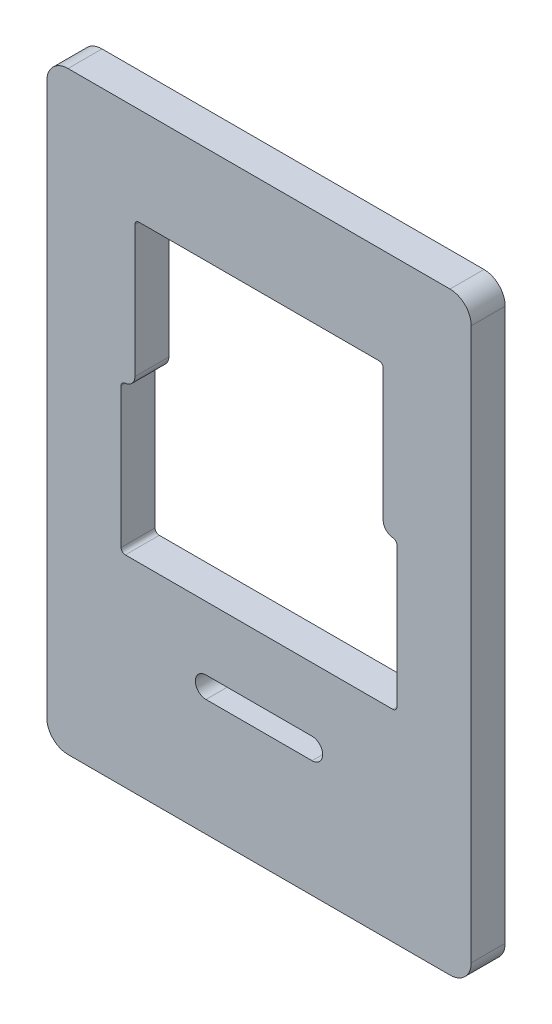
from build123d import *

# Parameters (mm, degrees)
MAINBODYS_W                = 20
MAINBODYS_H                = 28
MAIN_BODY_DEPTH            = 1.6
GROUND_CUT_DEPTH           = 18.278888853
MIDCUTS_W                  = 13
MIDCUTS_H                  = 7
MID_CUT_DEPTH              = 18.278888853
TOPPOWERACCESSCUTS_W       = 11.7
TOPPOWERACCESSCUTS_H       = 6.9
TOP_POWER_ACCESS_CUT_DEPTH = 18.278888853
MC_FILLET_R                = 0.5
ALL_INNER_CUTS_FILLETS_R   = 0.2
OUTER_FILLETS_R            = 1


with BuildPart() as part:
    # MainBodyS → MAIN BODY (new body)
    with BuildSketch(Plane.XY):
        Rectangle(MAINBODYS_W, MAINBODYS_H)
    extrude(amount=-MAIN_BODY_DEPTH)

    # GroundCutS → GROUND CUT (cut, through all)
    with BuildSketch(Plane.XY):
        with BuildLine():
            Line((-2.5, -7.5), (2.5, -7.5))
            ThreePointArc((2.5, -7.5), (3, -8), (2.5, -8.5))
            Line((2.5, -8.5), (-2.5, -8.5))
            ThreePointArc((-2.5, -8.5), (-3, -8), (-2.5, -7.5))
        make_face()
    extrude(amount=-GROUND_CUT_DEPTH, mode=Mode.SUBTRACT)

    # MidCutS → MID CUT (cut, through all)
    with BuildSketch(Plane.XY):
        with Locations((0, -1)):
            Rectangle(MIDCUTS_W, MIDCUTS_H)
    extrude(amount=-MID_CUT_DEPTH, mode=Mode.SUBTRACT)

    # TopPowerAccessCutS → TOP POWER ACCESS CUT (cut, through all)
    with BuildSketch(Plane.XY):
        with Locations((0, 5.95)):
            Rectangle(TOPPOWERACCESSCUTS_W, TOPPOWERACCESSCUTS_H)
    extrude(amount=-TOP_POWER_ACCESS_CUT_DEPTH, mode=Mode.SUBTRACT)

    # MC FILLET
    mc_fillet_edges = [part.edges().sort_by_distance(p)[0] for p in [
        (5.85, 2.5, -0.8),
        (-5.85, 2.5, -0.8),
    ]]
    fillet(mc_fillet_edges, radius=MC_FILLET_R)

    # ALL INNER CUTS FILLETS
    all_inner_cuts_fillets_edges = [part.edges().sort_by_distance(p)[0] for p in [
        (-6.5, -4.5, -0.8),
        (6.5, -4.5, -0.8),
        (6.5, 2.5, -0.8),
        (-6.5, 2.5, -0.8),
        (-5.85, 9.4, -0.8),
        (5.85, 9.4, -0.8),
    ]]
    fillet(all_inner_cuts_fillets_edges, radius=ALL_INNER_CUTS_FILLETS_R)

    # OUTER FILLETS
    outer_fillets_edges = [part.edges().sort_by_distance(p)[0] for p in [
        (10, -14, -0.8),
        (-10, -14, -0.8),
        (-10, 14, -0.8),
        (10, 14, -0.8),
    ]]
    fillet(outer_fillets_edges, radius=OUTER_FILLETS_R)


solid = part.part
